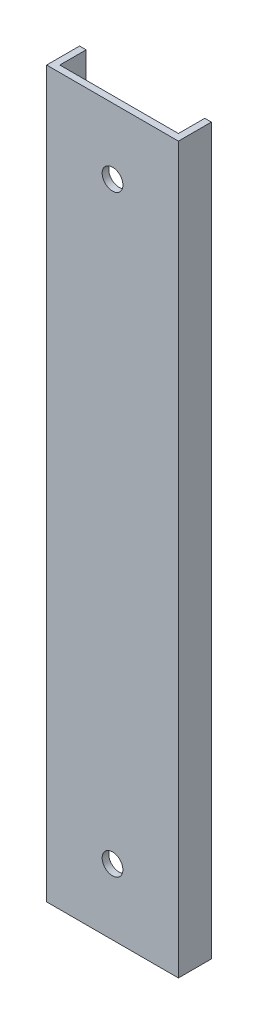
from build123d import *

# Parameters (mm, degrees)
BOSS_EXTRUDE1_DEPTH = 279.4
CUT_EXTRUDE1_REACH  = 282.839
SKETCH2_R           = 4.0000047


with BuildPart() as part:
    # Sketch1 → Boss-Extrude1 (new body)
    with BuildSketch(Plane(origin=(0, 0, 0), x_dir=(1, 0, 0), z_dir=(0, 1, 0))):
        Polygon((-22.86, 2.54), (-22.86, 12.7), (-25.4, 12.7), (-25.4, 0), (25.4, 0), (25.4, 12.7), (22.86, 12.7), (22.86, 2.54), align=None)
    extrude(amount=BOSS_EXTRUDE1_DEPTH)

    # Sketch2 → Cut-Extrude1 (cut, up to next)
    with BuildSketch(Plane.XY, mode=Mode.PRIVATE) as cut_extrude1_sk1:
        with Locations((0, 25.4)):
            Circle(SKETCH2_R)
    cut_extrude1_tool1 = extrude(cut_extrude1_sk1.sketch, amount=-CUT_EXTRUDE1_REACH, mode=Mode.PRIVATE) & part.part
    # Sketch2 → Cut-Extrude1 (cut, up to next)
    with BuildSketch(Plane.XY, mode=Mode.PRIVATE) as cut_extrude1_sk2:
        with Locations((0, 254)):
            Circle(SKETCH2_R)
    cut_extrude1_tool2 = extrude(cut_extrude1_sk2.sketch, amount=-CUT_EXTRUDE1_REACH, mode=Mode.PRIVATE) & part.part
    add(cut_extrude1_tool1.solids().sort_by_distance((0, 25.4, 0))[0], mode=Mode.SUBTRACT)
    add(cut_extrude1_tool2.solids().sort_by_distance((0, 254, 0))[0], mode=Mode.SUBTRACT)


solid = part.part
